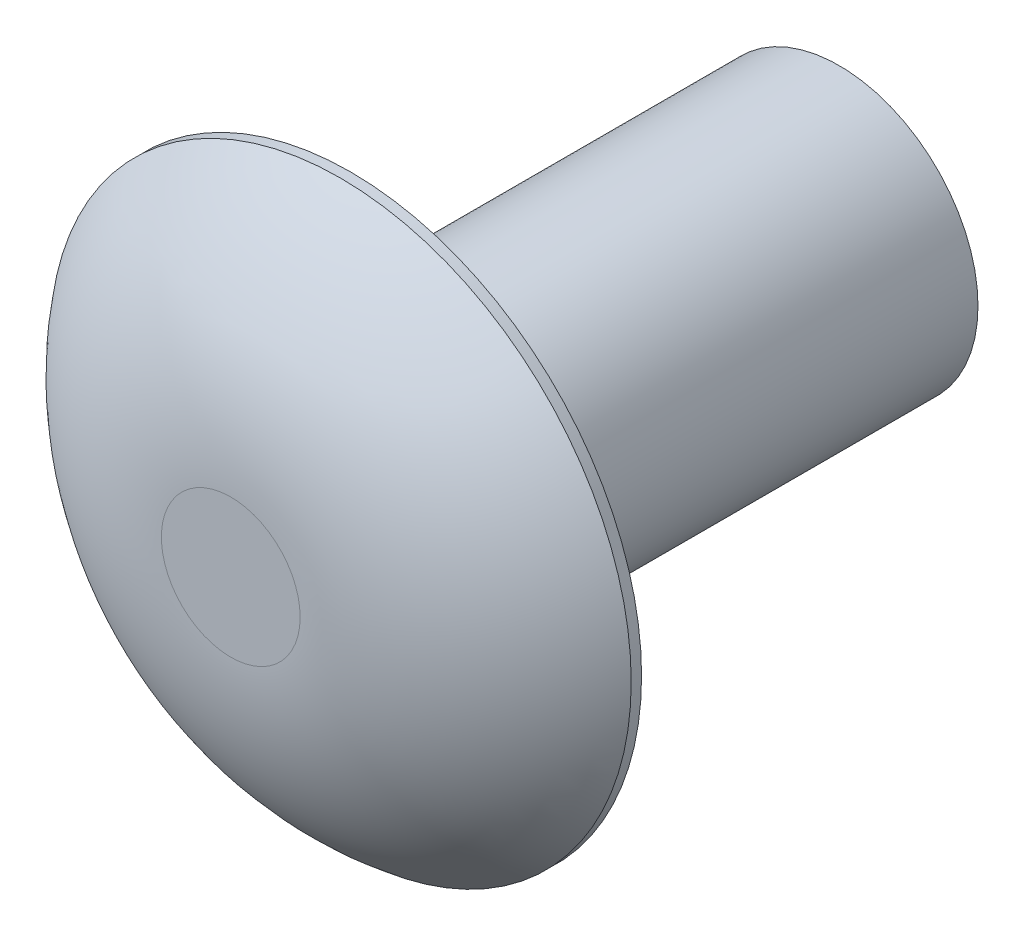
from build123d import *

# Parameters (mm, degrees)
CUT_EXTRUDE1_DEPTH      = 21.101424287
CUT_EXTRUDE1_DEPTH_BACK = 21.101424287
CUT_EXTRUDE2_DEPTH      = 21.101424287
CUT_EXTRUDE2_DEPTH_BACK = 21.101424287
FILLET2_R               = 0.254
CUT_EXTRUDE3_DEPTH      = 21.101424287
CUT_EXTRUDE3_DEPTH_BACK = 21.101424287
SKETCH7_W               = 2.38125
SKETCH7_H               = 17.740225881


with BuildPart() as part:
    # Sketch2 → Revolve1 (revolve)
    with BuildSketch(Plane(origin=(0, 0, 0), x_dir=(0, 0, -1), z_dir=(1, 0, 0)), mode=Mode.PRIVATE) as revolve1_sk:
        with BuildLine():
            Line((-18.8214, 0), (-18.8214, 1.190625))
            Line((-18.8214, 1.190625), (-2.0574, 1.190625))
            ThreePointArc((-2.0574, 1.190625), (-1.561820484, 3.310560517), (-0.1778, 4.9911))
            Line((-0.1778, 4.9911), (0, 4.9911))
            Line((0, 4.9911), (0, 2.38125))
            Line((0, 2.38125), (8.382, 2.38125))
            Line((8.382, 2.38125), (8.382, 2.24506403))
            Line((8.382, 2.24506403), (8.382, 0))
            Line((8.382, 0), (-18.8214, 0))
        make_face()
    revolve(revolve1_sk.sketch.rotate(Axis((0, 0, 18.8214), (0, 0, -1)), 90), axis=Axis((0, 0, 18.8214), (0, 0, -1)))

    # Sketch3 → Cut-Extrude1 (cut, two sides: drawn at the far end of the back side and taken through both)
    with BuildSketch(Plane(origin=(0, 0, 0), x_dir=(1, 0, 0), z_dir=(0, 1, 0)).offset(-CUT_EXTRUDE1_DEPTH_BACK)):
        Polygon((0, -18.8214), (1.393825, -17.004931895), (1.393825, -19.3294), (-1.393825, -19.3294), (-1.393825, -17.004931895), align=None)
    extrude(amount=CUT_EXTRUDE1_DEPTH + CUT_EXTRUDE1_DEPTH_BACK, mode=Mode.SUBTRACT)

    # Sketch5 → Cut-Extrude2 (cut, two sides: drawn at the far end of the back side and taken through both)
    with BuildSketch(Plane(origin=(0, 0, 0), x_dir=(0, 0, -1), z_dir=(1, 0, 0)).offset(-CUT_EXTRUDE2_DEPTH_BACK)):
        Polygon((-18.8214, 0), (-17.26974729, 1.508125), (-19.1389, 1.508125), (-19.1389, -1.508125), (-17.26974729, -1.508125), align=None)
    extrude(amount=CUT_EXTRUDE2_DEPTH + CUT_EXTRUDE2_DEPTH_BACK, mode=Mode.SUBTRACT)

    # Fillet2
    fillet2_edges = [part.edges().sort_by_distance(p)[0] for p in [
        (-2.38125, 0, 0),
    ]]
    fillet(fillet2_edges, radius=FILLET2_R)

    # Sketch7 → Cut-Extrude3 (cut, two sides: drawn at the far end of the back side and taken through both)
    with BuildSketch(Plane(origin=(0, 0, 0), x_dir=(1, 0, 0), z_dir=(0, 1, 0)).offset(-CUT_EXTRUDE3_DEPTH_BACK)):
        with Locations((0, -10.927512941)):
            Rectangle(SKETCH7_W, SKETCH7_H)
    extrude(amount=CUT_EXTRUDE3_DEPTH + CUT_EXTRUDE3_DEPTH_BACK, mode=Mode.SUBTRACT)


solid = part.part
